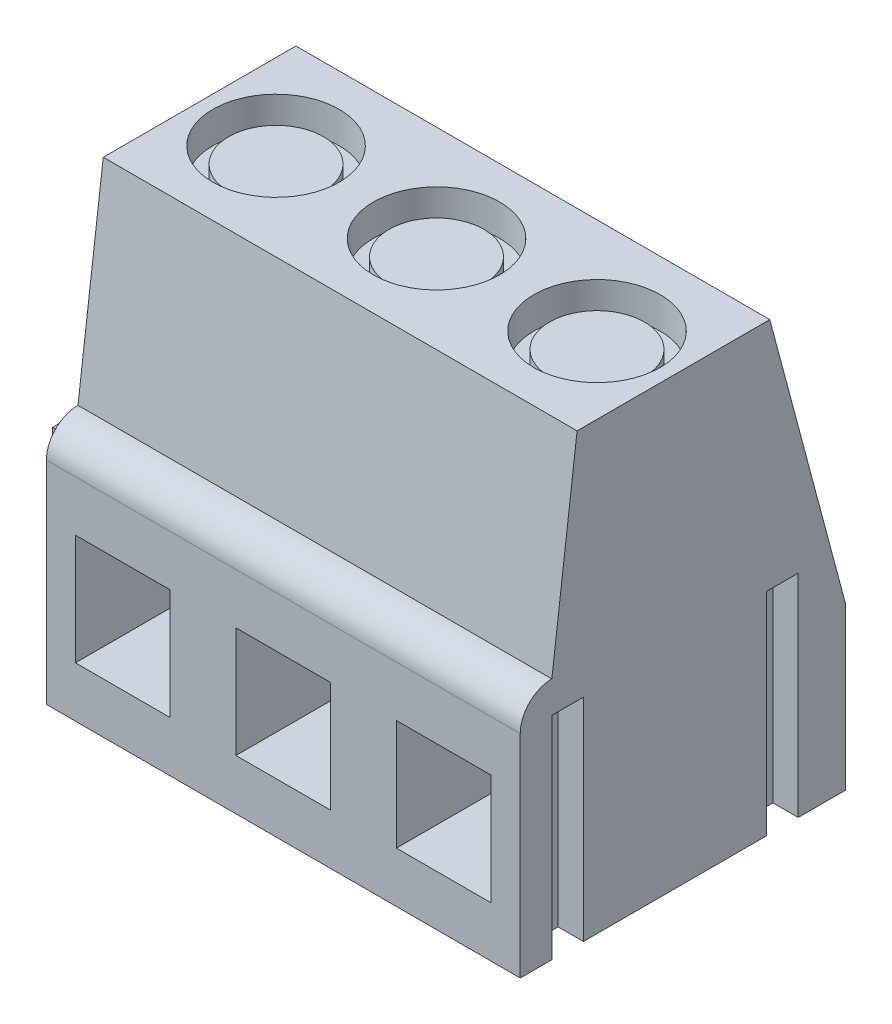
from build123d import *

# Parameters (mm, degrees)
BOSS_EXTRUDE2_DEPTH = 15
SKETCH4_R           = 2
CUT_EXTRUDE1_DEPTH  = 1
SKETCH5_R           = 1.5
BOSS_EXTRUDE3_DEPTH = 0.5
SKETCH7_W           = 3
SKETCH7_H           = 3.5
CUT_EXTRUDE2_DEPTH  = 6
LPATTERN1_COUNT     = 3
LPATTERN1_PITCH     = 5.08
SKETCH8_W           = 1
SKETCH8_H           = 6.7
BOSS_EXTRUDE4_DEPTH = 0.8
SKETCH9_W           = 1
SKETCH9_H           = 6.7
CUT_EXTRUDE3_DEPTH  = 0.8


with BuildPart() as part:
    # Sketch3 → Boss-Extrude2 (new body)
    with BuildSketch(Plane(origin=(0, 0, 0), x_dir=(0, 0, -1), z_dir=(1, 0, 0))):
        with BuildLine():
            Line((-5.15, 0), (5.15, 0))
            Line((5.15, 0), (5.15, 5.1))
            Line((5.15, 5.1), (2.75, 14.1))
            Line((2.75, 14.1), (-3.35, 14.1))
            Line((-3.35, 14.1), (-4.15, 7.7))
            ThreePointArc((-4.15, 7.7), (-4.857106781, 7.407106781), (-5.15, 6.7))
            Line((-5.15, 6.7), (-5.15, 0))
        make_face()
    extrude(amount=BOSS_EXTRUDE2_DEPTH)

    # Sketch4 → Cut-Extrude1 (cut)
    with BuildSketch(Plane(origin=(0, 14.1, 0), x_dir=(1, 0, 0), z_dir=(0, 1, 0))):
        with Locations(Location((7.5, -0.3, 0), (0, 0, 270))):
            Circle(SKETCH4_R)
    cut_extrude1 = extrude(amount=-CUT_EXTRUDE1_DEPTH, mode=Mode.SUBTRACT)

    # Sketch5 → Boss-Extrude3 (add)
    with BuildSketch(Plane(origin=(0, 13.1, 0), x_dir=(1, 0, 0), z_dir=(0, 1, 0))):
        with Locations(Location((7.5, -0.3, 0), (0, 0, 270))):
            Circle(SKETCH5_R)
    boss_extrude3 = extrude(amount=BOSS_EXTRUDE3_DEPTH)

    # Sketch-Pattern1: Cut-Extrude1, Boss-Extrude3 at 2 more places
    with Locations((5.08, 0, 0), (-5.08, 0, 0)):
        add(cut_extrude1, mode=Mode.SUBTRACT)
        add(boss_extrude3)

    # Sketch7 → Cut-Extrude2 (cut)
    with BuildSketch(Plane.XY.offset(5.15)):
        with Locations((12.58, 3.35)):
            Rectangle(SKETCH7_W, SKETCH7_H)
    cut_extrude2 = extrude(amount=-CUT_EXTRUDE2_DEPTH, mode=Mode.SUBTRACT)

    # LPattern1: Cut-Extrude2 ×3
    with Locations(*[(-i * LPATTERN1_PITCH, 0, 0) for i in range(1, LPATTERN1_COUNT)]):
        add(cut_extrude2, mode=Mode.SUBTRACT)

    # Sketch8 → Boss-Extrude4 (add)
    with BuildSketch(Plane.ZY):
        with Locations((3.65, 3.35)):
            Rectangle(SKETCH8_W, SKETCH8_H)
        with Locations((-3.15, 3.35)):
            Rectangle(SKETCH8_W, SKETCH8_H)
    extrude(amount=BOSS_EXTRUDE4_DEPTH)

    # Sketch9 → Cut-Extrude3 (cut)
    with BuildSketch(Plane(origin=(15, 0, 0), x_dir=(0, 0, -1), z_dir=(1, 0, 0))):
        with Locations((3.15, 3.35)):
            Rectangle(SKETCH9_W, SKETCH9_H)
        with Locations((-3.65, 3.35)):
            Rectangle(SKETCH9_W, SKETCH9_H)
    extrude(amount=-CUT_EXTRUDE3_DEPTH, mode=Mode.SUBTRACT)


solid = part.part
